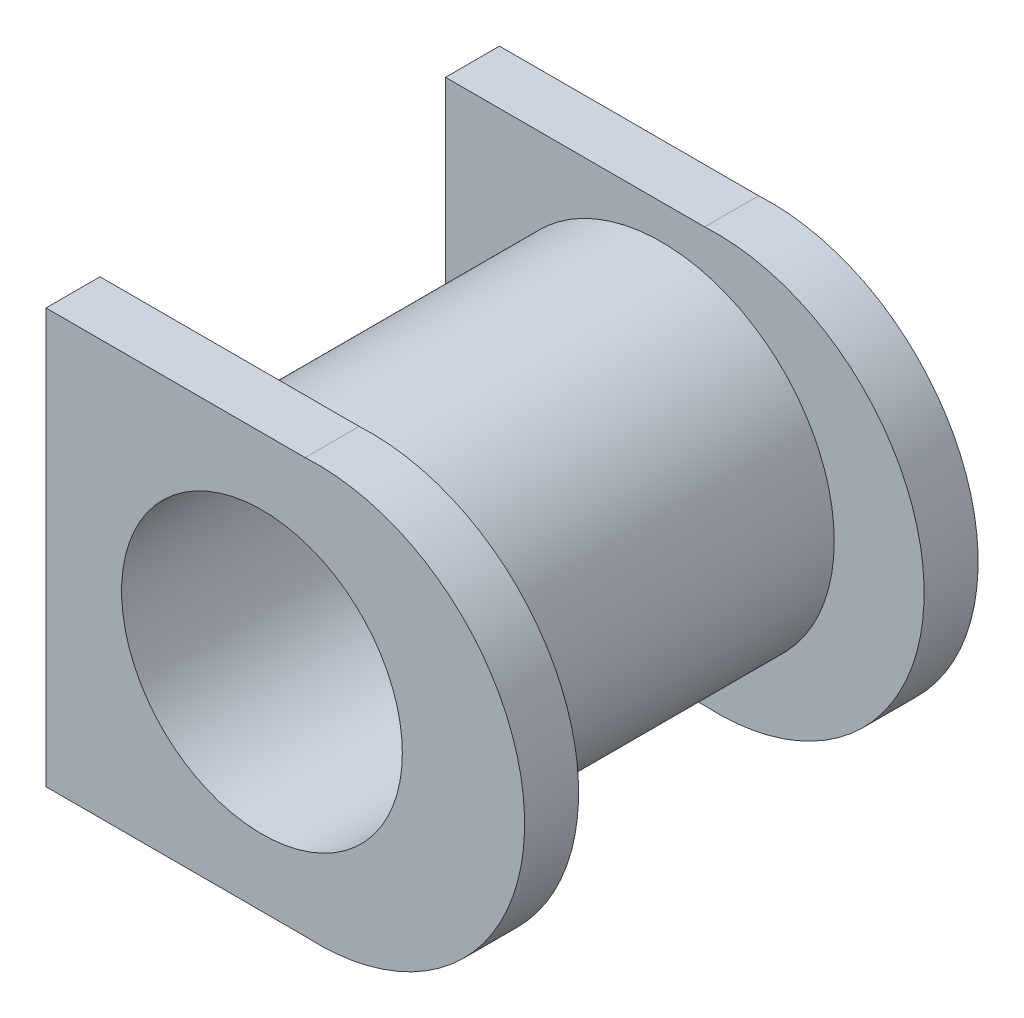
from build123d import *

# Parameters (mm, degrees)
BOSS_EXTRUDE1_DEPTH     = 12.5
SKETCH2_R               = 40
BOSS_EXTRUDE2_DEPTH     = 80
BOSS_EXTRUDE3_DEPTH     = 12.5
CUT_EXTRUDE2_DEPTH      = 132.903899543
CUT_EXTRUDE2_DEPTH_BACK = 132.903899543
SKETCH6_R               = 32.5


with BuildPart() as part:
    # Sketch1 → Boss-Extrude1 (new body)
    with BuildSketch(Plane.XY):
        with BuildLine():
            Line((-30, -48), (30, -48))
            ThreePointArc((30, -48), (80.813999827, 0), (30, 48))
            Line((30, 48), (-30, 48))
            Line((-30, 48), (-30, -48))
        make_face()
    extrude(amount=BOSS_EXTRUDE1_DEPTH)

    # Sketch2 → Boss-Extrude2 (add)
    with BuildSketch(Plane.XY.offset(12.5)):
        with Locations((20, 0)):
            Circle(SKETCH2_R)
    extrude(amount=BOSS_EXTRUDE2_DEPTH)

    # Sketch3 → Boss-Extrude3 (add)
    with BuildSketch(Plane.XY.offset(92.5)):
        with BuildLine():
            Line((-30, 48), (-30, -48))
            Line((-30, -48), (30, -48))
            ThreePointArc((30, -48), (80.813999827, 0), (30, 48))
            Line((30, 48), (-30, 48))
        make_face()
    extrude(amount=BOSS_EXTRUDE3_DEPTH)

    # Sketch6 → Cut-Extrude2 (cut, two sides: drawn at the far end of the back side and taken through both)
    with BuildSketch(Plane.XY.offset(12.5).offset(-CUT_EXTRUDE2_DEPTH_BACK)):
        with Locations((20, 0)):
            Circle(SKETCH6_R)
    extrude(amount=CUT_EXTRUDE2_DEPTH + CUT_EXTRUDE2_DEPTH_BACK, mode=Mode.SUBTRACT)


solid = part.part
